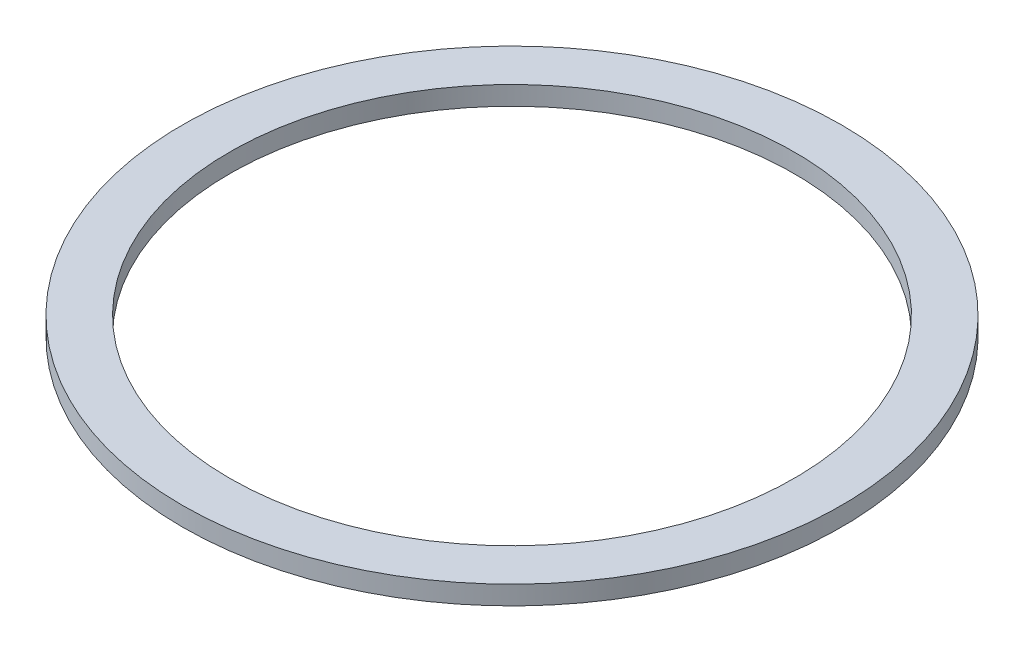
from build123d import *

# Parameters (mm, degrees)
SKETCH_1_R      = 17.5
SKETCH_1_R_2    = 15
EXTRUDE_1_DEPTH = 1


with BuildPart() as part:
    # 草图1 → 凸台-拉伸1 (new body)
    with BuildSketch(Plane(origin=(0, 0, 0), x_dir=(1, 0, 0), z_dir=(0, 1, 0))):
        with Locations(Location((0, 0, 0), (0, 0, 270))):
            Circle(SKETCH_1_R)
        with Locations(Location((0, 0, 0), (0, 0, 270))):
            Circle(SKETCH_1_R_2, mode=Mode.SUBTRACT)
    extrude(amount=EXTRUDE_1_DEPTH)


solid = part.part
